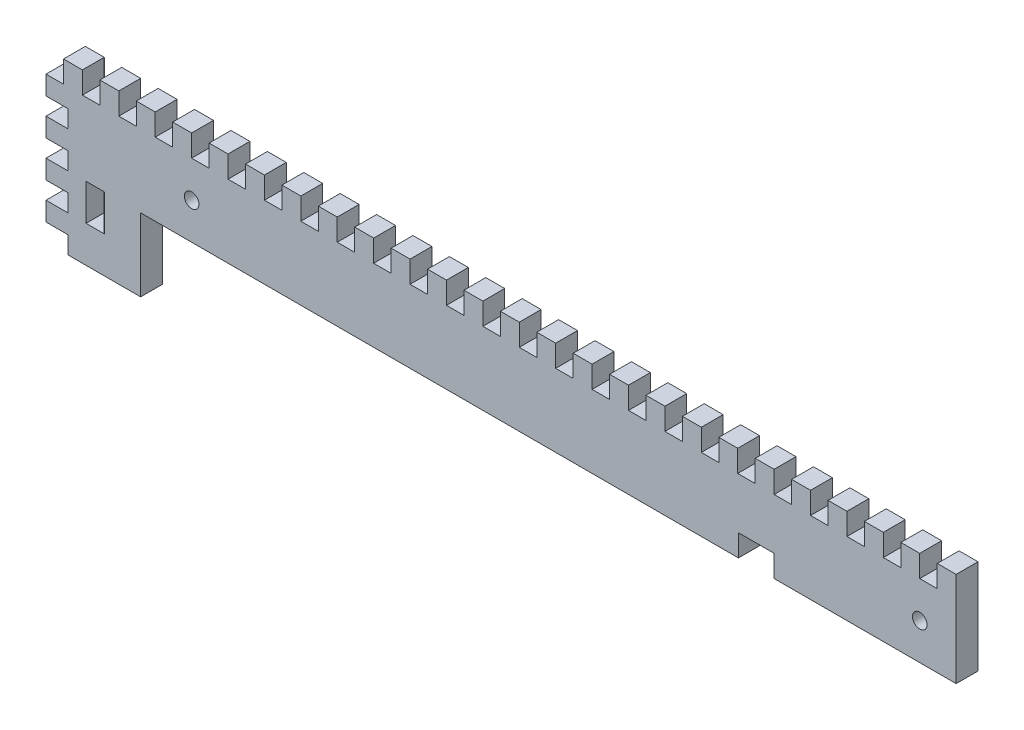
from build123d import *

# Parameters (mm, degrees)
ESQUISSE1_R        = 2
ESQUISSE1_W        = 5
ESQUISSE1_H        = 10
BOSS_EXTRU_1_DEPTH = 6


with BuildPart() as part:
    # Esquisse1 → Boss.-Extru.1 (new body)
    with BuildSketch(Plane.XY):
        Polygon((0, 0), (0, 26), (-5.2, 26), (-5.2, 20), (-10, 20), (-10, 26), (-15.2, 26), (-15.2, 20), (-20, 20), (-20, 26), (-25.2, 26), (-25.2, 20), (-30, 20), (-30, 26), (-35.2, 26), (-35.2, 20), (-40, 20), (-40, 26), (-45.2, 26), (-45.2, 20), (-50, 20), (-50, 26), (-55.2, 26), (-55.2, 20), (-60, 20), (-60, 26), (-65.2, 26), (-65.2, 20), (-70, 20), (-70, 26), (-75.2, 26), (-75.2, 20), (-80, 20), (-80, 26), (-85.2, 26), (-85.2, 20), (-90, 20), (-90, 26), (-95.2, 26), (-95.2, 20), (-100, 20), (-100, 26), (-105.2, 26), (-105.2, 20), (-110, 20), (-110, 26), (-115.2, 26), (-115.2, 20), (-120, 20), (-120, 26), (-125.2, 26), (-125.2, 20), (-130, 20), (-130, 26), (-135.2, 26), (-135.2, 20), (-140, 20), (-140, 26), (-145.2, 26), (-145.2, 20), (-150, 20), (-150, 26), (-155.2, 26), (-155.2, 20), (-160, 20), (-160, 26), (-165.2, 26), (-165.2, 20), (-170, 20), (-170, 26), (-175.2, 26), (-175.2, 20), (-180, 20), (-180, 26), (-185.2, 26), (-185.2, 20), (-190, 20), (-190, 26), (-195.2, 26), (-195.2, 20), (-200, 20), (-200, 26), (-205.2, 26), (-205.2, 20), (-210, 20), (-210, 26), (-215.2, 26), (-215.2, 20), (-220, 20), (-220, 26), (-225.2, 26), (-225.2, 20), (-230, 20), (-230, 26), (-235.2, 26), (-235.2, 20), (-240, 20), (-240, 26), (-245.2, 26), (-245.2, 20), (-250, 20), (-250, 14.8), (-244, 14.8), (-244, 10), (-250, 10), (-250, 4.8), (-244, 4.8), (-244, 0), (-250, 0), (-250, -5.2), (-244, -5.2), (-244, -10), (-250, -10), (-250, -15.2), (-244, -15.2), (-244, -20), (-224, -20), (-224, 0), (-59.8, 0), (-59.8, 6), (-50, 6), (-50, 0), align=None)
        with Locations((-210, 10)):
            Circle(ESQUISSE1_R, mode=Mode.SUBTRACT)
        with Locations((-10, 10)):
            Circle(ESQUISSE1_R, mode=Mode.SUBTRACT)
        with Locations((-236.5, -5)):
            Rectangle(ESQUISSE1_W, ESQUISSE1_H, mode=Mode.SUBTRACT)
    extrude(amount=BOSS_EXTRU_1_DEPTH)


solid = part.part
